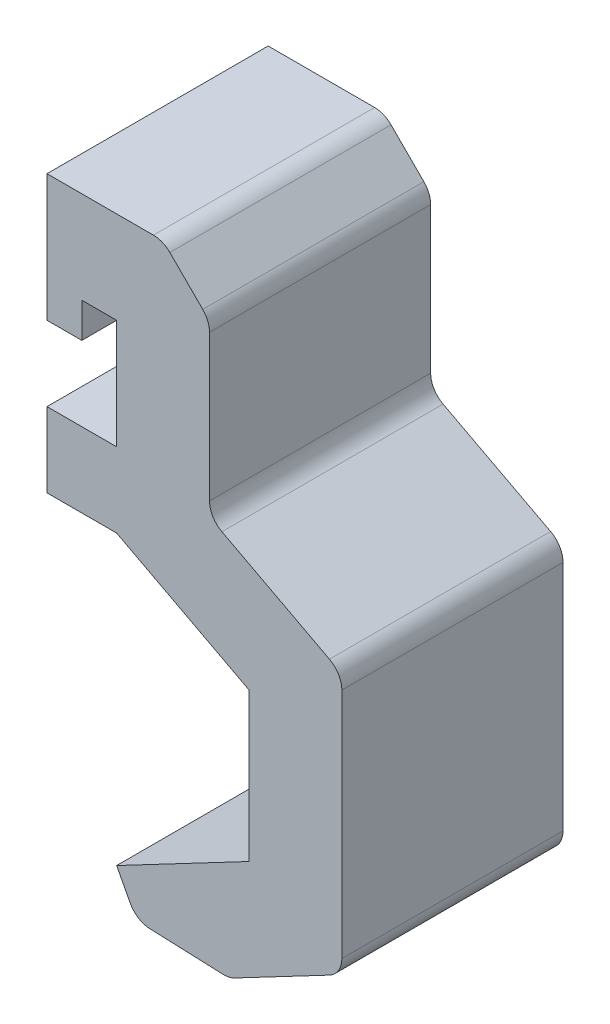
from build123d import *

# Parameters (mm, degrees)
BOSS_EXTRUDE1_DEPTH = 4.7625
CHAMFER1_SIZE       = 1
FILLET1_R           = 0.5
CHAMFER2_SIZE       = 1
CHAMFER2_SIZE2      = 1.732050808
FILLET2_R           = 0.5


with BuildPart() as part:
    # Sketch2 → Boss-Extrude1 (new body)
    with BuildSketch(Plane.XY):
        Polygon((22.5, 12.6474909), (25.35, 11.1474909), (25.35, 7.9474909), (22.5, 6.4474909), (23.392083301, 4.752532628), (27.35, 6.83564668), (27.35, 12.446879518), (24.5, 13.946879518), (24.5, 18.6006159), (22.5, 18.6006159), (21, 18.6006159), (21, 16.6162409), (21, 15.8662409), (21.75, 15.8662409), (21.75, 16.6162409), (22.5, 16.6162409), (22.5, 14.2568659), (21, 14.2568659), (21, 12.6474909), align=None)
    extrude(amount=BOSS_EXTRUDE1_DEPTH)

    # Chamfer1
    chamfer1_edges = [part.edges().sort_by_distance(p)[0] for p in [
        (24.5, 18.6006159, 2.38125),
    ]]
    chamfer(chamfer1_edges, length=CHAMFER1_SIZE)

    # Fillet1
    fillet1_edges = [part.edges().sort_by_distance(p)[0] for p in [
        (24.5, 13.946879518, 2.38125),
        (27.35, 12.446879518, 2.38125),
        (27.35, 6.83564668, 2.38125),
        (23.5, 18.6006159, 2.38125),
        (24.5, 17.6006159, 2.38125),
    ]]
    fillet(fillet1_edges, radius=FILLET1_R)

    # Chamfer2
    chamfer2_edges = [part.edges().sort_by_distance(p)[0] for p in [
        (23.392083301, 4.752532628, 2.38125),
    ]]
    chamfer2_side = [part.faces().sort_by_distance(p)[0] for p in [
        (22.946041651, 5.600011764, 2.38125),
    ]]
    chamfer(chamfer2_edges, length=CHAMFER2_SIZE, length2=CHAMFER2_SIZE2, reference=chamfer2_side[0])

    # Fillet2
    fillet2_edges = [part.edges().sort_by_distance(p)[0] for p in [
        (24.924806623, 5.559229113, 2.38125),
        (22.926336868, 5.63745085, 2.38125),
    ]]
    fillet(fillet2_edges, radius=FILLET2_R)


solid = part.part
